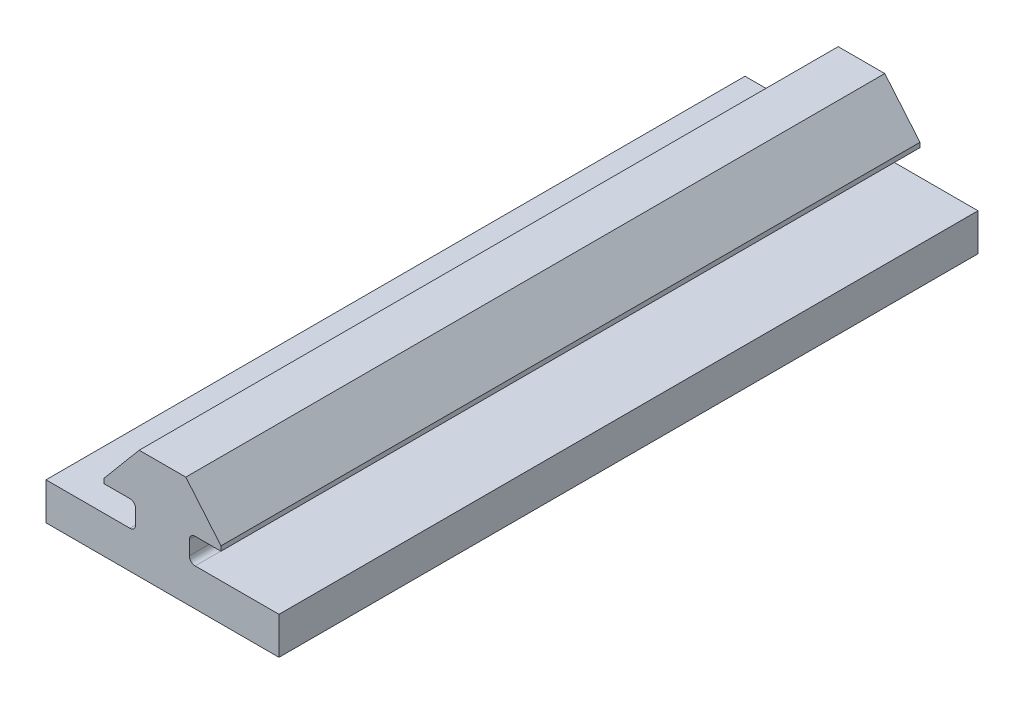
from build123d import *

# Parameters (mm, degrees)
BOSS_EXTRUDE6_DEPTH = 76.2


with BuildPart() as part:
    # Sketch1 → Boss-Extrude6 (new body)
    with BuildSketch(Plane(origin=(0, 0, -3683), x_dir=(-1, 0, 0), z_dir=(0, 0, -1))):
        with BuildLine():
            Line((12.7, 4.064), (3.556, 4.064))
            ThreePointArc((3.556, 4.064), (3.106987194, 4.249987194), (2.921, 4.699))
            Line((2.921, 4.699), (2.921, 6.223))
            ThreePointArc((2.921, 6.223), (3.106987194, 6.672012806), (3.556, 6.858))
            Line((3.556, 6.858), (6.376363549, 6.858))
            Line((6.376363549, 6.858), (6.376363549, 7.365999958))
            Line((6.376363549, 7.365999958), (2.54, 11.938))
            Line((2.54, 11.938), (-2.54, 11.938))
            Line((-2.54, 11.938), (-6.376363549, 7.365999958))
            Line((-6.376363549, 7.365999958), (-6.376363549, 6.858))
            Line((-6.376363549, 6.858), (-3.556, 6.858))
            ThreePointArc((-3.556, 6.858), (-3.106987194, 6.672012806), (-2.921, 6.223))
            Line((-2.921, 6.223), (-2.921, 4.699))
            ThreePointArc((-2.921, 4.699), (-3.106987194, 4.249987194), (-3.556, 4.064))
            Line((-3.556, 4.064), (-12.7, 4.064))
            Line((-12.7, 4.064), (-12.7, 0))
            Line((-12.7, 0), (12.7, 0))
            Line((12.7, 0), (12.7, 4.064))
        make_face()
    extrude(amount=BOSS_EXTRUDE6_DEPTH)


solid = part.part
